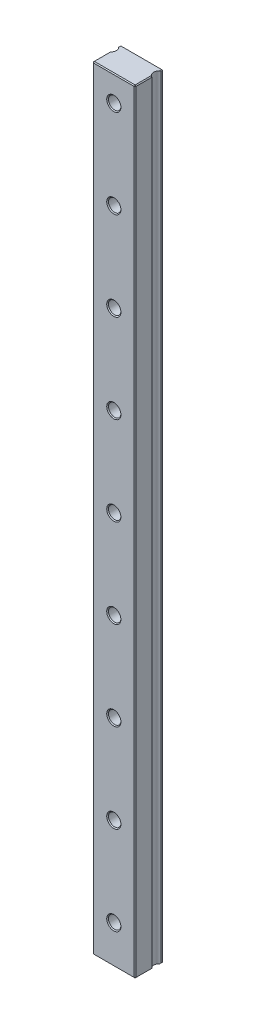
from build123d import *

# Parameters (mm, degrees)
BOSS_EXTRUDE1_DEPTH = 218
SKETCH3_R           = 1.75
CUT_EXTRUDE3_DEPTH  = 8.5
SKETCH3_6_R         = 3.25
SKETCH3_6_R_2       = 1.75
CUT_EXTRUDE4_DEPTH  = 4.5
CHAMFER3_SIZE       = 0.25


with BuildPart() as part:
    # Sketch1 → Boss-Extrude1 (new body)
    with BuildSketch(Plane(origin=(0, 0, 0), x_dir=(1, 0, 0), z_dir=(0, 1, 0))):
        with BuildLine():
            Line((6, 4), (-6, 4))
            Line((-6, 4), (-6, 3.299038106))
            ThreePointArc((-6, 3.299038106), (-5.25, 2), (-6, 0.700961894))
            Line((-6, 0.700961894), (-6, -4))
            Line((-6, -4), (6, -4))
            Line((6, -4), (6, 0.700961894))
            ThreePointArc((6, 0.700961894), (5.25, 2), (6, 3.299038106))
            Line((6, 3.299038106), (6, 4))
        make_face()
    extrude(amount=BOSS_EXTRUDE1_DEPTH)

    # Sketch3 → Cut-Extrude3 (cut)
    with BuildSketch(Plane(origin=(0, 0, -4), x_dir=(-1, 0, 0), z_dir=(0, 0, -1))):
        with Locations((0, 10.75)):
            Circle(SKETCH3_R)
        with Locations((0, 35.75)):
            Circle(SKETCH3_R)
        with Locations((0, 60.75)):
            Circle(SKETCH3_R)
        with Locations((0, 85.75)):
            Circle(SKETCH3_R)
        with Locations((0, 110.75)):
            Circle(SKETCH3_R)
        with Locations((0, 135.75)):
            Circle(SKETCH3_R)
        with Locations((0, 160.75)):
            Circle(SKETCH3_R)
        with Locations((0, 185.75)):
            Circle(SKETCH3_R)
        with Locations((0, 210.75)):
            Circle(SKETCH3_R)
        with Locations((0, 235.75)):
            Circle(SKETCH3_R)
        with Locations((0, 260.75)):
            Circle(SKETCH3_R)
        with Locations((0, 285.75)):
            Circle(SKETCH3_R)
        with Locations((0, 310.75)):
            Circle(SKETCH3_R)
        with Locations((0, 335.75)):
            Circle(SKETCH3_R)
    extrude(amount=-CUT_EXTRUDE3_DEPTH, mode=Mode.SUBTRACT)

    # Sketch3<6> → Cut-Extrude4 (cut)
    # profile 1 of 14: a face of its own
    with BuildSketch(Plane(origin=(0, 0, -4), x_dir=(-1, 0, 0), z_dir=(0, 0, -1))):
        with Locations((0, 10.75)):
            Circle(SKETCH3_6_R)
        with Locations((0, 10.75)):
            Circle(SKETCH3_6_R_2, mode=Mode.SUBTRACT)
    # profile 2 of 14: a face of its own
    with BuildSketch(Plane(origin=(0, 0, -4), x_dir=(-1, 0, 0), z_dir=(0, 0, -1))):
        with Locations((0, 35.75)):
            Circle(SKETCH3_6_R)
        with Locations((0, 35.75)):
            Circle(SKETCH3_6_R_2, mode=Mode.SUBTRACT)
    # profile 3 of 14: a face of its own
    with BuildSketch(Plane(origin=(0, 0, -4), x_dir=(-1, 0, 0), z_dir=(0, 0, -1))):
        with Locations((0, 60.75)):
            Circle(SKETCH3_6_R)
        with Locations((0, 60.75)):
            Circle(SKETCH3_6_R_2, mode=Mode.SUBTRACT)
    # profile 4 of 14: a face of its own
    with BuildSketch(Plane(origin=(0, 0, -4), x_dir=(-1, 0, 0), z_dir=(0, 0, -1))):
        with Locations((0, 85.75)):
            Circle(SKETCH3_6_R)
        with Locations((0, 85.75)):
            Circle(SKETCH3_6_R_2, mode=Mode.SUBTRACT)
    # profile 5 of 14: a face of its own
    with BuildSketch(Plane(origin=(0, 0, -4), x_dir=(-1, 0, 0), z_dir=(0, 0, -1))):
        with Locations((0, 110.75)):
            Circle(SKETCH3_6_R)
        with Locations((0, 110.75)):
            Circle(SKETCH3_6_R_2, mode=Mode.SUBTRACT)
    # profile 6 of 14: a face of its own
    with BuildSketch(Plane(origin=(0, 0, -4), x_dir=(-1, 0, 0), z_dir=(0, 0, -1))):
        with Locations((0, 135.75)):
            Circle(SKETCH3_6_R)
        with Locations((0, 135.75)):
            Circle(SKETCH3_6_R_2, mode=Mode.SUBTRACT)
    # profile 7 of 14: a face of its own
    with BuildSketch(Plane(origin=(0, 0, -4), x_dir=(-1, 0, 0), z_dir=(0, 0, -1))):
        with Locations((0, 160.75)):
            Circle(SKETCH3_6_R)
        with Locations((0, 160.75)):
            Circle(SKETCH3_6_R_2, mode=Mode.SUBTRACT)
    # profile 8 of 14: a face of its own
    with BuildSketch(Plane(origin=(0, 0, -4), x_dir=(-1, 0, 0), z_dir=(0, 0, -1))):
        with Locations((0, 185.75)):
            Circle(SKETCH3_6_R)
        with Locations((0, 185.75)):
            Circle(SKETCH3_6_R_2, mode=Mode.SUBTRACT)
    # profile 9 of 14: a face of its own
    with BuildSketch(Plane(origin=(0, 0, -4), x_dir=(-1, 0, 0), z_dir=(0, 0, -1))):
        with Locations((0, 210.75)):
            Circle(SKETCH3_6_R)
        with Locations((0, 210.75)):
            Circle(SKETCH3_6_R_2, mode=Mode.SUBTRACT)
    # profile 10 of 14: a face of its own
    with BuildSketch(Plane(origin=(0, 0, -4), x_dir=(-1, 0, 0), z_dir=(0, 0, -1))):
        with Locations((0, 235.75)):
            Circle(SKETCH3_6_R)
        with Locations((0, 235.75)):
            Circle(SKETCH3_6_R_2, mode=Mode.SUBTRACT)
    # profile 11 of 14: a face of its own
    with BuildSketch(Plane(origin=(0, 0, -4), x_dir=(-1, 0, 0), z_dir=(0, 0, -1))):
        with Locations((0, 260.75)):
            Circle(SKETCH3_6_R)
        with Locations((0, 260.75)):
            Circle(SKETCH3_6_R_2, mode=Mode.SUBTRACT)
    # profile 12 of 14: a face of its own
    with BuildSketch(Plane(origin=(0, 0, -4), x_dir=(-1, 0, 0), z_dir=(0, 0, -1))):
        with Locations((0, 285.75)):
            Circle(SKETCH3_6_R)
        with Locations((0, 285.75)):
            Circle(SKETCH3_6_R_2, mode=Mode.SUBTRACT)
    # profile 13 of 14: a face of its own
    with BuildSketch(Plane(origin=(0, 0, -4), x_dir=(-1, 0, 0), z_dir=(0, 0, -1))):
        with Locations((0, 310.75)):
            Circle(SKETCH3_6_R)
        with Locations((0, 310.75)):
            Circle(SKETCH3_6_R_2, mode=Mode.SUBTRACT)
    # profile 14 of 14: a face of its own
    with BuildSketch(Plane(origin=(0, 0, -4), x_dir=(-1, 0, 0), z_dir=(0, 0, -1))):
        with Locations((0, 335.75)):
            Circle(SKETCH3_6_R)
        with Locations((0, 335.75)):
            Circle(SKETCH3_6_R_2, mode=Mode.SUBTRACT)
    extrude(amount=-CUT_EXTRUDE4_DEPTH, mode=Mode.SUBTRACT)

    # Chamfer3
    chamfer3_edges = [part.edges().sort_by_distance(p)[0] for p in [
        (1.75, 210.75, 4),
        (1.75, 185.75, 4),
        (1.75, 160.75, 4),
        (1.75, 135.75, 4),
        (1.75, 110.75, 4),
        (1.75, 85.75, 4),
        (1.75, 60.75, 4),
        (1.75, 35.75, 4),
        (1.75, 10.75, 4),
        (0, 0, 4),
        (6, 0, 1.649519053),
        (-6, 0, 1.649519053),
        (6, 218, 1.649519053),
        (-6, 218, 1.649519053),
        (6, 109, 4),
        (0, 218, 4),
        (-6, 109, 4),
        (6, 0, -3.649519053),
        (-6, 0, -3.649519053),
        (0, 0, -4),
        (6, 218, -3.649519053),
        (-6, 218, -3.649519053),
        (-6, 109, -4),
        (0, 218, -4),
        (6, 109, -4),
        (3.25, 210.75, -4),
        (1.75, 210.75, 0.5),
        (3.25, 185.75, -4),
        (1.75, 185.75, 0.5),
        (3.25, 160.75, -4),
        (1.75, 160.75, 0.5),
        (3.25, 135.75, -4),
        (1.75, 135.75, 0.5),
        (3.25, 110.75, -4),
        (1.75, 110.75, 0.5),
        (3.25, 85.75, -4),
        (1.75, 85.75, 0.5),
        (3.25, 60.75, -4),
        (1.75, 60.75, 0.5),
        (3.25, 35.75, -4),
        (1.75, 35.75, 0.5),
        (3.25, 10.75, -4),
        (1.75, 10.75, 0.5),
    ]]
    chamfer(chamfer3_edges, length=CHAMFER3_SIZE)


solid = part.part
